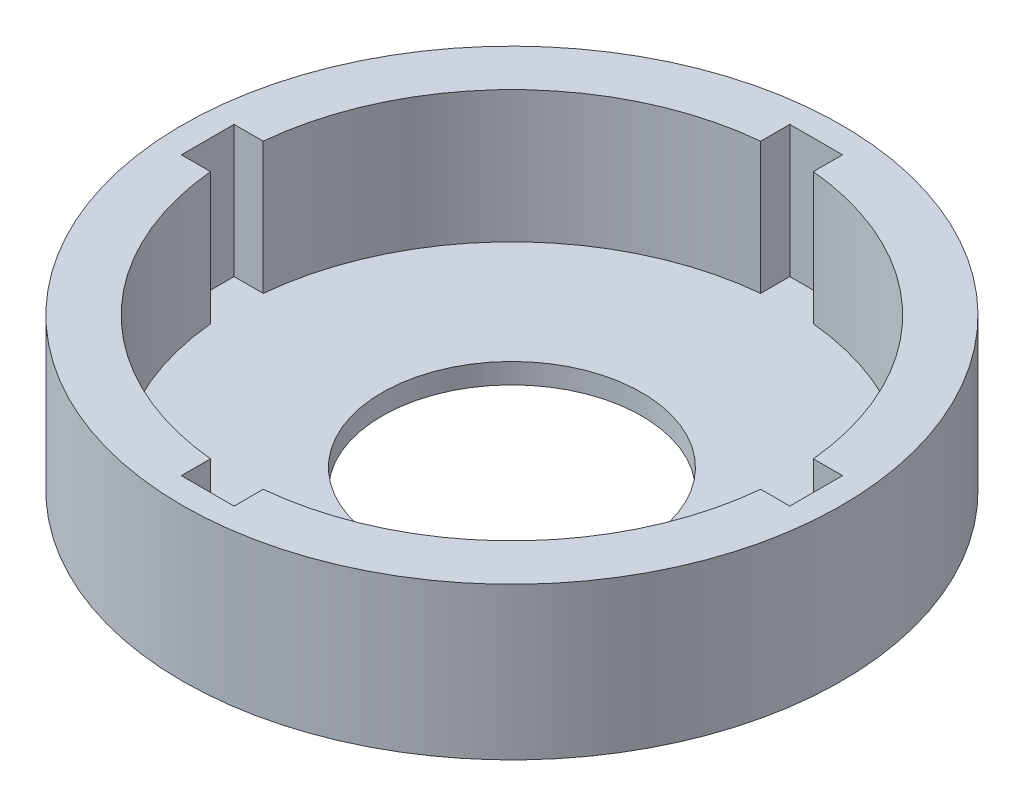
from build123d import *

# Parameters (mm, degrees)
SKETCH1_R           = 32.5
SKETCH1_R_2         = 12.8
BOSS_EXTRUDE1_DEPTH = 2
SKETCH2_R           = 32.5
BOSS_EXTRUDE2_DEPTH = 13


with BuildPart() as part:
    # Sketch1 → Boss-Extrude1 (new body)
    with BuildSketch(Plane(origin=(0, 0, 0), x_dir=(1, 0, 0), z_dir=(0, 1, 0))):
        with Locations(Location((0, 0, 0), (0, 0, 270))):
            Circle(SKETCH1_R)
        with Locations(Location((0, 0, 0), (0, 0, 270))):
            Circle(SKETCH1_R_2, mode=Mode.SUBTRACT)
    extrude(amount=BOSS_EXTRUDE1_DEPTH)

    # Sketch2 → Boss-Extrude2 (add)
    with BuildSketch(Plane(origin=(0, 2, 0), x_dir=(1, 0, 0), z_dir=(0, 1, 0))):
        with Locations(Location((0, 0, 0), (0, 0, 270))):
            Circle(SKETCH2_R)
        with BuildLine():
            Line((2.6, -27.125679715), (2.6, -30))
            Line((2.6, -30), (-2.6, -30))
            Line((-2.6, -30), (-2.6, -27.125679715))
            ThreePointArc((-2.6, -27.125679715), (-19.268659787, -19.268659787), (-27.125679715, -2.6))
            Line((-27.125679715, -2.6), (-30, -2.6))
            Line((-30, -2.6), (-30, 2.6))
            Line((-30, 2.6), (-27.125679715, 2.6))
            ThreePointArc((-27.125679715, 2.6), (-19.268659787, 19.268659787), (-2.6, 27.125679715))
            Line((-2.6, 27.125679715), (-2.6, 30))
            Line((-2.6, 30), (2.6, 30))
            Line((2.6, 30), (2.6, 27.125679715))
            ThreePointArc((2.6, 27.125679715), (19.268659787, 19.268659787), (27.125679715, 2.6))
            Line((27.125679715, 2.6), (30, 2.6))
            Line((30, 2.6), (30, -2.6))
            Line((30, -2.6), (27.125679715, -2.6))
            ThreePointArc((27.125679715, -2.6), (19.268659787, -19.268659787), (2.6, -27.125679715))
        make_face(mode=Mode.SUBTRACT)
    extrude(amount=BOSS_EXTRUDE2_DEPTH)


solid = part.part
